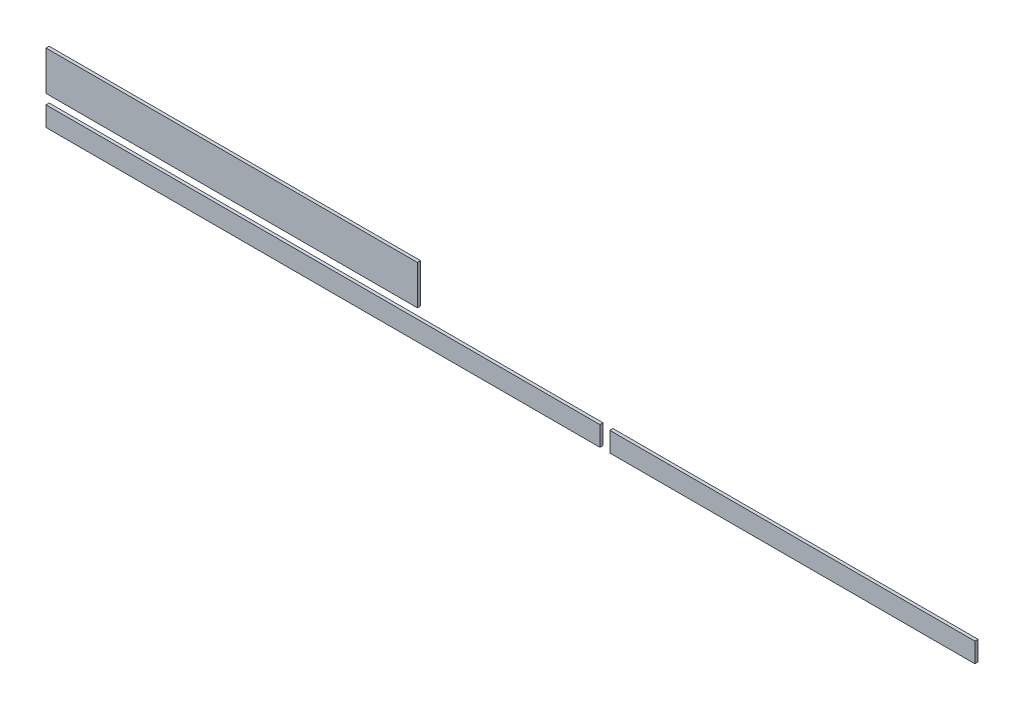
from build123d import *

# Parameters (mm, degrees)
SKETCH2_W             = 281.47
SKETCH2_H             = 10
BOSS_EXTRUDE1_DEPTH   = 1.5875
SKETCH2_W_2           = 185.53
BOSS_EXTRUDE1_2_DEPTH = 1.5875
SKETCH2_W_3           = 188.71
SKETCH2_H_2           = 20
BOSS_EXTRUDE1_3_DEPTH = 1.5875


with BuildPart() as part:
    # Sketch2 → Boss-Extrude1 (new body)
    with BuildSketch(Plane.XY):
        with Locations((140.735, 5)):
            Rectangle(SKETCH2_W, SKETCH2_H)
    extrude(amount=BOSS_EXTRUDE1_DEPTH)


with BuildPart() as body_2:
    # Sketch2 → Boss-Extrude1 2 (new body)
    with BuildSketch(Plane.XY):
        with Locations((379.235, 5)):
            Rectangle(SKETCH2_W_2, SKETCH2_H)
    extrude(amount=BOSS_EXTRUDE1_2_DEPTH)


with BuildPart() as body_3:
    # Sketch2 → Boss-Extrude1 3 (new body)
    with BuildSketch(Plane.XY):
        with Locations((94.355, 25)):
            Rectangle(SKETCH2_W_3, SKETCH2_H_2)
    extrude(amount=BOSS_EXTRUDE1_3_DEPTH)


solid = Compound([part.part, body_2.part, body_3.part])
